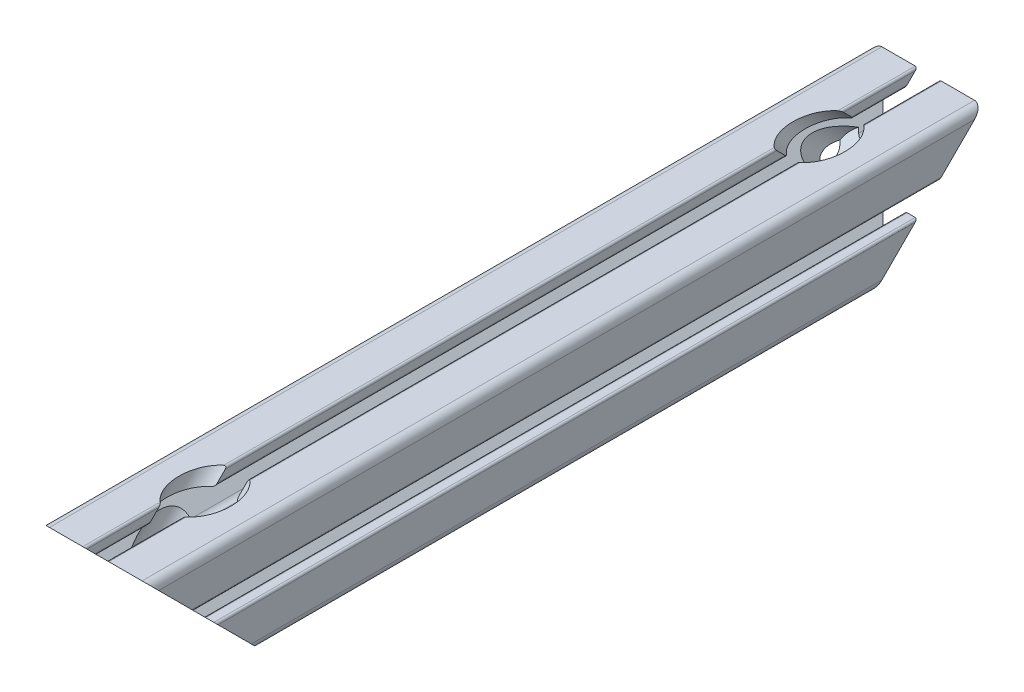
from build123d import *

# Parameters (mm, degrees)
SKETCH1_R               = 3.4036
BOSS_EXTRUDE1_DEPTH     = 152.4
CUT_EXTRUDE1_DEPTH      = 156.002451594
CUT_EXTRUDE1_DEPTH_BACK = 156.002451594


with BuildPart() as part:
    # Sketch1 → Boss-Extrude1 (new, symmetric)
    with BuildSketch(Plane.XY):
        with BuildLine():
            Line((-20, 16.952), (-20, 4.7625))
            ThreePointArc((-20, 4.7625), (-19.776815367, 4.223684633), (-19.238, 4.0005))
            Line((-19.238, 4.0005), (-16.2662, 4.0005))
            ThreePointArc((-16.2662, 4.0005), (-15.727384633, 4.223684633), (-15.5042, 4.7625))
            Line((-15.5042, 4.7625), (-15.5042, 10.2235))
            ThreePointArc((-15.5042, 10.2235), (-15.033804775, 10.927496204), (-14.203384633, 10.762315367))
            Line((-14.203384633, 10.762315367), (-8.635059555, 5.19399029))
            ThreePointArc((-8.635059555, 5.19399029), (-7.985348265, 4.221628629), (-7.7572, 3.074649845))
            Line((-7.7572, 3.074649845), (-7.7572, -3.074649845))
            ThreePointArc((-7.7572, -3.074649845), (-7.985348265, -4.221628629), (-8.635059555, -5.19399029))
            Line((-8.635059555, -5.19399029), (-14.203384633, -10.762315367))
            ThreePointArc((-14.203384633, -10.762315367), (-15.033804775, -10.927496204), (-15.5042, -10.2235))
            Line((-15.5042, -10.2235), (-15.5042, -4.7625))
            ThreePointArc((-15.5042, -4.7625), (-15.727384633, -4.223684633), (-16.2662, -4.0005))
            Line((-16.2662, -4.0005), (-19.238, -4.0005))
            ThreePointArc((-19.238, -4.0005), (-19.776815367, -4.223684633), (-20, -4.7625))
            Line((-20, -4.7625), (-20, -16.952))
            ThreePointArc((-20, -16.952), (-19.107261469, -19.107261469), (-16.952, -20))
            Line((-16.952, -20), (-4.7625, -20))
            ThreePointArc((-4.7625, -20), (-4.223684633, -19.776815367), (-4.0005, -19.238))
            Line((-4.0005, -19.238), (-4.0005, -16.2662))
            ThreePointArc((-4.0005, -16.2662), (-4.223684633, -15.727384633), (-4.7625, -15.5042))
            Line((-4.7625, -15.5042), (-10.2235, -15.5042))
            ThreePointArc((-10.2235, -15.5042), (-10.927496204, -15.033804775), (-10.762315367, -14.203384633))
            Line((-10.762315367, -14.203384633), (-5.19399029, -8.635059555))
            ThreePointArc((-5.19399029, -8.635059555), (-4.221628629, -7.985348265), (-3.074649845, -7.7572))
            Line((-3.074649845, -7.7572), (3.074649845, -7.7572))
            ThreePointArc((3.074649845, -7.7572), (4.221628629, -7.985348265), (5.19399029, -8.635059555))
            Line((5.19399029, -8.635059555), (10.762315367, -14.203384633))
            ThreePointArc((10.762315367, -14.203384633), (10.927496204, -15.033804775), (10.2235, -15.5042))
            Line((10.2235, -15.5042), (4.7625, -15.5042))
            ThreePointArc((4.7625, -15.5042), (4.223684633, -15.727384633), (4.0005, -16.2662))
            Line((4.0005, -16.2662), (4.0005, -19.238))
            ThreePointArc((4.0005, -19.238), (4.223684633, -19.776815367), (4.7625, -20))
            Line((4.7625, -20), (16.952, -20))
            ThreePointArc((16.952, -20), (19.107261469, -19.107261469), (20, -16.952))
            Line((20, -16.952), (20, -4.7625))
            ThreePointArc((20, -4.7625), (19.776815367, -4.223684633), (19.238, -4.0005))
            Line((19.238, -4.0005), (16.2662, -4.0005))
            ThreePointArc((16.2662, -4.0005), (15.727384633, -4.223684633), (15.5042, -4.7625))
            Line((15.5042, -4.7625), (15.5042, -10.2235))
            ThreePointArc((15.5042, -10.2235), (15.033804775, -10.927496204), (14.203384633, -10.762315367))
            Line((14.203384633, -10.762315367), (8.635059555, -5.19399029))
            ThreePointArc((8.635059555, -5.19399029), (7.985348265, -4.221628629), (7.7572, -3.074649845))
            Line((7.7572, -3.074649845), (7.7572, 3.074649845))
            ThreePointArc((7.7572, 3.074649845), (7.985348265, 4.221628629), (8.635059555, 5.19399029))
            Line((8.635059555, 5.19399029), (14.203384633, 10.762315367))
            ThreePointArc((14.203384633, 10.762315367), (15.033804775, 10.927496204), (15.5042, 10.2235))
            Line((15.5042, 10.2235), (15.5042, 4.7625))
            ThreePointArc((15.5042, 4.7625), (15.727384633, 4.223684633), (16.2662, 4.0005))
            Line((16.2662, 4.0005), (19.238, 4.0005))
            ThreePointArc((19.238, 4.0005), (19.776815367, 4.223684633), (20, 4.7625))
            Line((20, 4.7625), (20, 16.952))
            ThreePointArc((20, 16.952), (19.107261469, 19.107261469), (16.952, 20))
            Line((16.952, 20), (4.7625, 20))
            ThreePointArc((4.7625, 20), (4.223684633, 19.776815367), (4.0005, 19.238))
            Line((4.0005, 19.238), (4.0005, 16.2662))
            ThreePointArc((4.0005, 16.2662), (4.223684633, 15.727384633), (4.7625, 15.5042))
            Line((4.7625, 15.5042), (10.2235, 15.5042))
            ThreePointArc((10.2235, 15.5042), (10.927496204, 15.033804775), (10.762315367, 14.203384633))
            Line((10.762315367, 14.203384633), (5.19399029, 8.635059555))
            ThreePointArc((5.19399029, 8.635059555), (4.221628629, 7.985348265), (3.074649845, 7.7572))
            Line((3.074649845, 7.7572), (-3.074649845, 7.7572))
            ThreePointArc((-3.074649845, 7.7572), (-4.221628629, 7.985348265), (-5.19399029, 8.635059555))
            Line((-5.19399029, 8.635059555), (-10.762315367, 14.203384633))
            ThreePointArc((-10.762315367, 14.203384633), (-10.927496204, 15.033804775), (-10.2235, 15.5042))
            Line((-10.2235, 15.5042), (-4.7625, 15.5042))
            ThreePointArc((-4.7625, 15.5042), (-4.223684633, 15.727384633), (-4.0005, 16.2662))
            Line((-4.0005, 16.2662), (-4.0005, 19.238))
            ThreePointArc((-4.0005, 19.238), (-4.223684633, 19.776815367), (-4.7625, 20))
            Line((-4.7625, 20), (-16.952, 20))
            ThreePointArc((-16.952, 20), (-19.107261469, 19.107261469), (-20, 16.952))
        make_face()
        Circle(SKETCH1_R, mode=Mode.SUBTRACT)
    extrude(amount=BOSS_EXTRUDE1_DEPTH, both=True)

    # Sketch2 → Cut-Extrude1 (cut, two sides: drawn at the far end of the back side and taken through both)
    with BuildSketch(Plane(origin=(0, 0, 0), x_dir=(0, 0, -1), z_dir=(1, 0, 0)).offset(-CUT_EXTRUDE1_DEPTH_BACK)):
        Polygon((-152.4, 20), (-152.4, -20), (-112.4, -20), align=None)
        Polygon((112.4, -20), (152.4, 20), (152.4, -20), align=None)
    extrude(amount=CUT_EXTRUDE1_DEPTH + CUT_EXTRUDE1_DEPTH_BACK, mode=Mode.SUBTRACT)

    # Sketch3 → Cut-Revolve1 (revolve, cut)
    with BuildSketch(Plane(origin=(0, 0, 0), x_dir=(0, 0, -1), z_dir=(1, 0, 0))):
        Polygon((-105.682485579, 26.717514421), (-112.4, 33.435028843), (-134.6627417, 11.172287143), (-130.87972042, 7.389265863), (-135.334493142, 2.934493142), (-132.4, 0), align=None)
    cut_revolve1 = revolve(axis=Axis((0, -20, 152.4), (0, 0.7071067811865476, -0.7071067811865476)), mode=Mode.SUBTRACT)

    # Mirror1: Cut-Revolve1 across plane
    add(cut_revolve1.mirror(Plane.XY), mode=Mode.SUBTRACT)


solid = part.part
